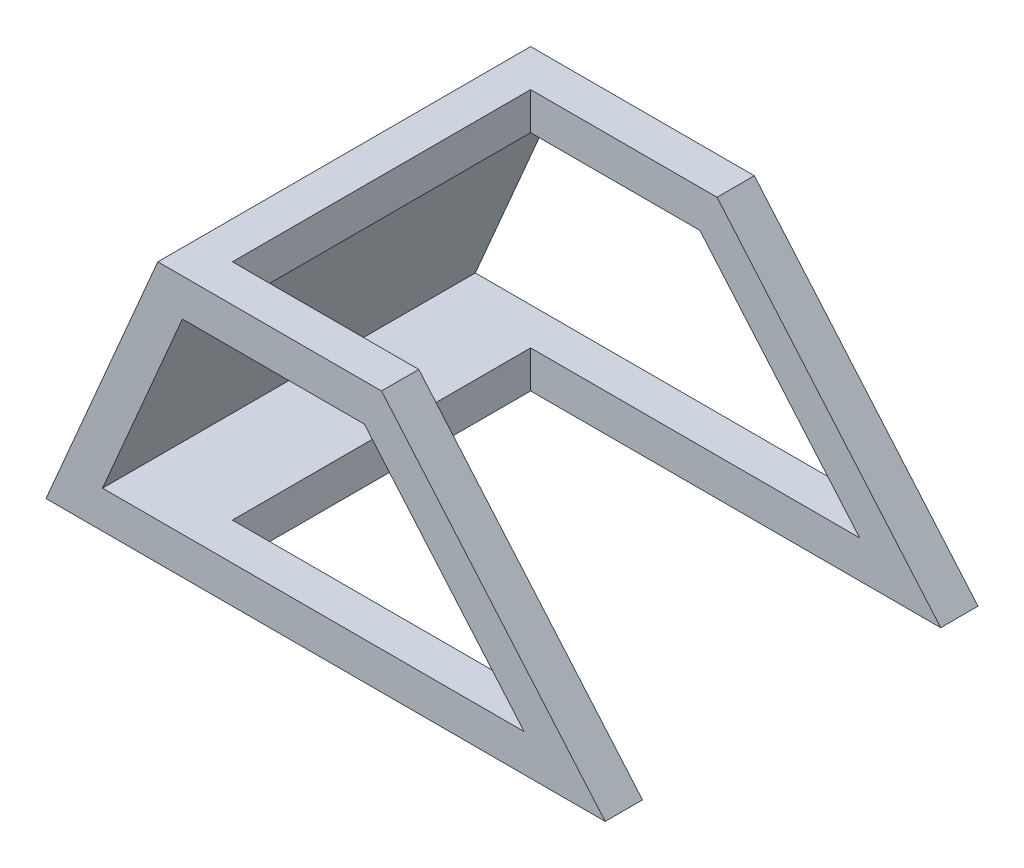
from build123d import *

# Parameters (mm, degrees)
BOSS_EXTRUDE2_DEPTH          = 100
CUT_EXTRUDE_THIN5_DEPTH      = 194.390796058
CUT_EXTRUDE_THIN5_DEPTH_BACK = 100


with BuildPart() as part:
    # Sketch1 → Boss-Extrude2 (new body)
    with BuildSketch(Plane.XY):
        Polygon((0, 0), (150, 0), (90, 70), (30, 70), align=None)
        Polygon((36.59396158, 60), (15.165390151, 10), (128.257793632, 10), (85.400650775, 60), align=None, mode=Mode.SUBTRACT)
    extrude(amount=BOSS_EXTRUDE2_DEPTH)

    # Sketch10 → Cut-Extrude-Thin5 (cut, two sides: drawn at the far end of the back side and taken through both)
    with BuildSketch(Plane(origin=(0, 70, 0), x_dir=(1, 0, 0), z_dir=(0, 1, 0)).offset(-CUT_EXTRUDE_THIN5_DEPTH_BACK)):
        Polygon((150, -20), (50, -20), (50, -80), (150, -80), (150, -90), (40, -90), (40, -10), (150, -10), align=None)
    extrude(amount=CUT_EXTRUDE_THIN5_DEPTH + CUT_EXTRUDE_THIN5_DEPTH_BACK, mode=Mode.SUBTRACT)


with BuildPart() as body_2:
    # of the pieces the cut leaves, the one that is kept (cut_extrude_thin5_keep)
    add(part.part.solids().sort_by_distance((0, 0, 0))[0])


solid = body_2.part
